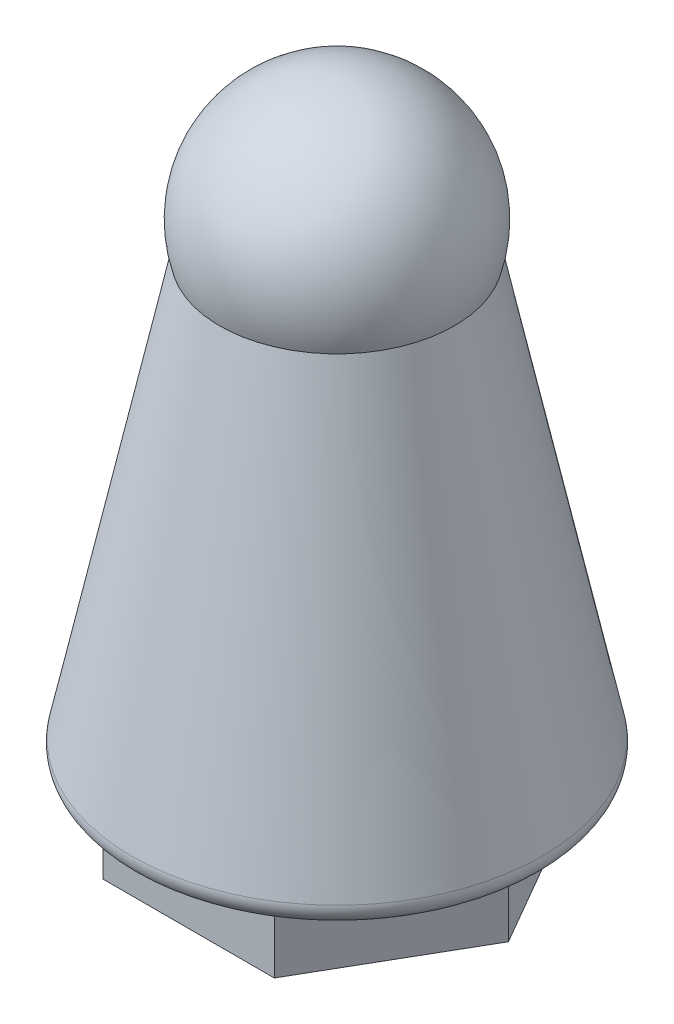
from build123d import *

# Parameters (mm, degrees)
SKETCH2_R           = 5
BOSS_EXTRUDE1_DEPTH = 8
FILLET1_R           = 1


with BuildPart() as part:
    # Sketch1 → Revolve1 (revolve)
    with BuildSketch(Plane.XY):
        with BuildLine():
            Line((-6.724338957, 69.005082459), (-12, 44.005082459))
            Line((-12, 44.005082459), (0, 44.005082459))
            Line((0, 44.005082459), (0, 77.950144306))
            ThreePointArc((0, 77.950144306), (-5.59532988, 75.156363932), (-6.724338957, 69.005082459))
        make_face()
    revolve(axis=Axis((0, 0, 0), (0, 1, 0)))

    # Sketch2 → Boss-Extrude1 (add)
    with BuildSketch(Plane.XZ.offset(-40.005082459)):
        Polygon((9.814954576, 0), (4.907477288, 8.5), (-4.907477288, 8.5), (-9.814954576, 0), (-4.907477288, -8.5), (4.907477288, -8.5), align=None)
        with Locations(Location((0, 0, 0), (0, 0, 270))):
            Circle(SKETCH2_R, mode=Mode.SUBTRACT)
    extrude(amount=-BOSS_EXTRUDE1_DEPTH)

    # Fillet1
    fillet1_edges = [part.edges().sort_by_distance(p)[0] for p in [
        (12, 44.005082459, 0),
    ]]
    fillet(fillet1_edges, radius=FILLET1_R)


solid = part.part
